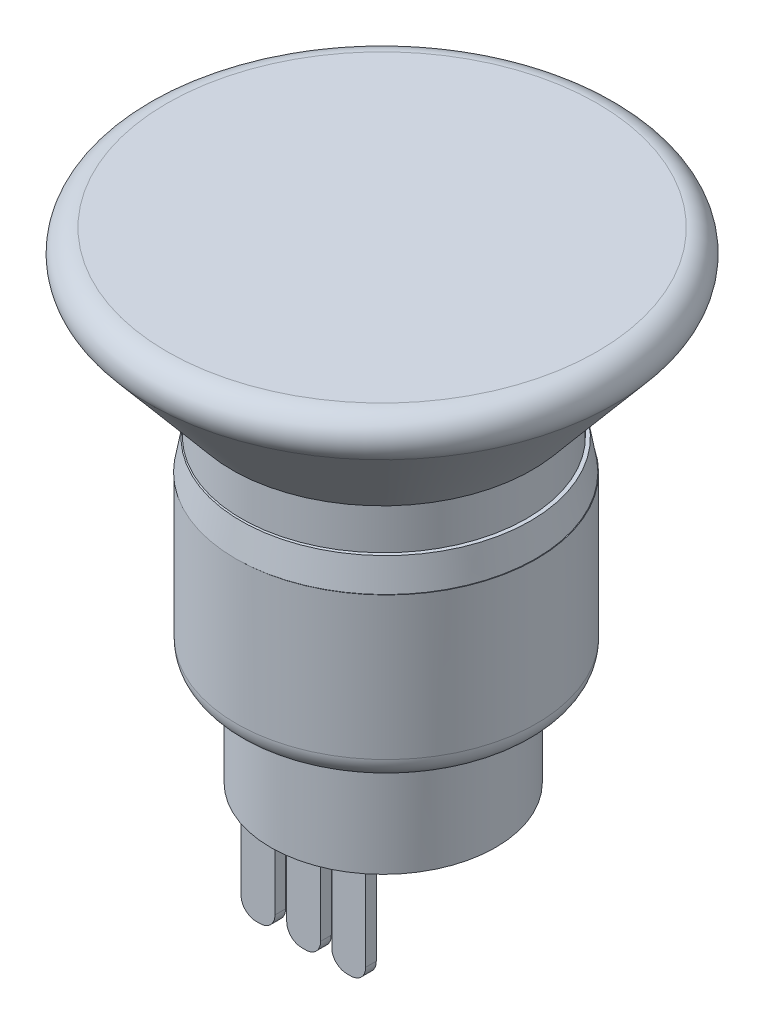
from build123d import *

# Parameters (mm, degrees)
ESQUISSE1_W        = 10
ESQUISSE1_H        = 11
ESQUISSE4_R        = 10
BOSS_EXTRU_1_DEPTH = 2
BOSS_EXTRU_1_TAPER = 10
ESQUISSE5_R        = 9.5
BOSS_EXTRU_2_DEPTH = 3
ESQUISSE6_R        = 10
BOSS_EXTRU_3_DEPTH = 9
BOSS_EXTRU_3_DRAFT = -40
CONG_2_R           = 1.5
ESQUISSE7_R        = 7.5
BOSS_EXTRU_4_DEPTH = 7
ESQUISSE8_W        = 2.259893414
ESQUISSE8_H        = 0.706216692
BOSS_EXTRU_5_DEPTH = 7
CONG_3_R           = 1


with BuildPart() as part:
    # Esquisse1 → Révol.-Mince1 (revolve)
    with BuildSketch(Plane(origin=(-11.198304594, 0, 0), x_dir=(1, 0, 0), z_dir=(0, 0, 1)), mode=Mode.PRIVATE) as r_vol_mince1_sk:
        with Locations((5, -13.913919414)):
            Rectangle(ESQUISSE1_W, ESQUISSE1_H)
    revolve(r_vol_mince1_sk.sketch.rotate(Axis((-11.198304594, -8.413919414, 0), (0, -1, 0)), 180), axis=Axis((-11.198304594, -8.413919414, 0), (0, -1, 0)))

    # Esquisse4 → Boss.-Extru.1 (add)
    with BuildSketch(Plane(origin=(0, -8.413919414, 0), x_dir=(1, 0, 0), z_dir=(0, 1, 0))):
        with Locations((-11.245263052, 0)):
            Circle(ESQUISSE4_R)
    extrude(amount=BOSS_EXTRU_1_DEPTH, taper=BOSS_EXTRU_1_TAPER)

    # Esquisse5 → Boss.-Extru.2 (add)
    with BuildSketch(Plane(origin=(0, -6.413919414, 0), x_dir=(1, 0, 0), z_dir=(0, 1, 0))):
        with Locations(Location((-11.36394571, 0, 0), (0, 0, 180))):
            Circle(ESQUISSE5_R)
    extrude(amount=BOSS_EXTRU_2_DEPTH)


with BuildPart() as boss_extru_3_tool:
    # Esquisse6 → Boss.-Extru.3 (with draft: the straight prism first)
    with BuildSketch(Plane(origin=(0, -3.413919414, 0), x_dir=(1, 0, 0), z_dir=(0, 1, 0))):
        with Locations((-11.482628368, 0)):
            Circle(ESQUISSE6_R)
    extrude(amount=BOSS_EXTRU_3_DEPTH)
    # Boss.-Extru.3: the draft: its side faces are tilted about the plane it starts from
    boss_extru_3_sides = [boss_extru_3_tool.faces().sort_by_distance(p)[0] for p in [
        (-21.482628368, 1.086080586, 0),
    ]]
    draft(boss_extru_3_sides, Plane(origin=(0, -3.413919414, 0), x_dir=(1, 0, 0), z_dir=(0, 1, 0)), BOSS_EXTRU_3_DRAFT)


with BuildPart() as part_1:
    add(part.part)

    # Boss.-Extru.3: add boss_extru_3_tool
    add(boss_extru_3_tool.part)

    # Congé2
    cong_2_edges = [part_1.edges().sort_by_distance(p)[0] for p in [
        (-29.034525049, 5.586080586, 0),
        (-1.198304594, -19.413919414, 0),
    ]]
    fillet(cong_2_edges, radius=CONG_2_R)

    # Esquisse7 → Boss.-Extru.4 (add)
    with BuildSketch(Plane(origin=(0, -19.413919414, 0), x_dir=(-1, 0, 0), z_dir=(0, -1, 0))):
        with Locations((11.412006699, 0)):
            Circle(ESQUISSE7_R)
    extrude(amount=BOSS_EXTRU_4_DEPTH)

    # Esquisse8 → Boss.-Extru.5 (add)
    with BuildSketch(Plane(origin=(0, -26.413919414, 0), x_dir=(-1, 0, 0), z_dir=(0, -1, 0))):
        with Locations((14.504595834, -4.896080188)):
            Rectangle(ESQUISSE8_W, ESQUISSE8_H)
        with Locations((8.460660903, -4.896080188)):
            Rectangle(ESQUISSE8_W, ESQUISSE8_H)
        with Locations((11.460660903, -4.896080188)):
            Rectangle(ESQUISSE8_W, ESQUISSE8_H)
    extrude(amount=BOSS_EXTRU_5_DEPTH)

    # Congé3
    cong_3_edges = [part_1.edges().sort_by_distance(p)[0] for p in [
        (-15.634542541, -33.413919414, 4.896080188),
        (-13.374649127, -33.413919414, 4.896080188),
        (-9.59060761, -33.413919414, 4.896080188),
        (-7.330714196, -33.413919414, 4.896080188),
        (-12.59060761, -33.413919414, 4.896080188),
        (-10.330714196, -33.413919414, 4.896080188),
    ]]
    fillet(cong_3_edges, radius=CONG_3_R)


solid = part_1.part
